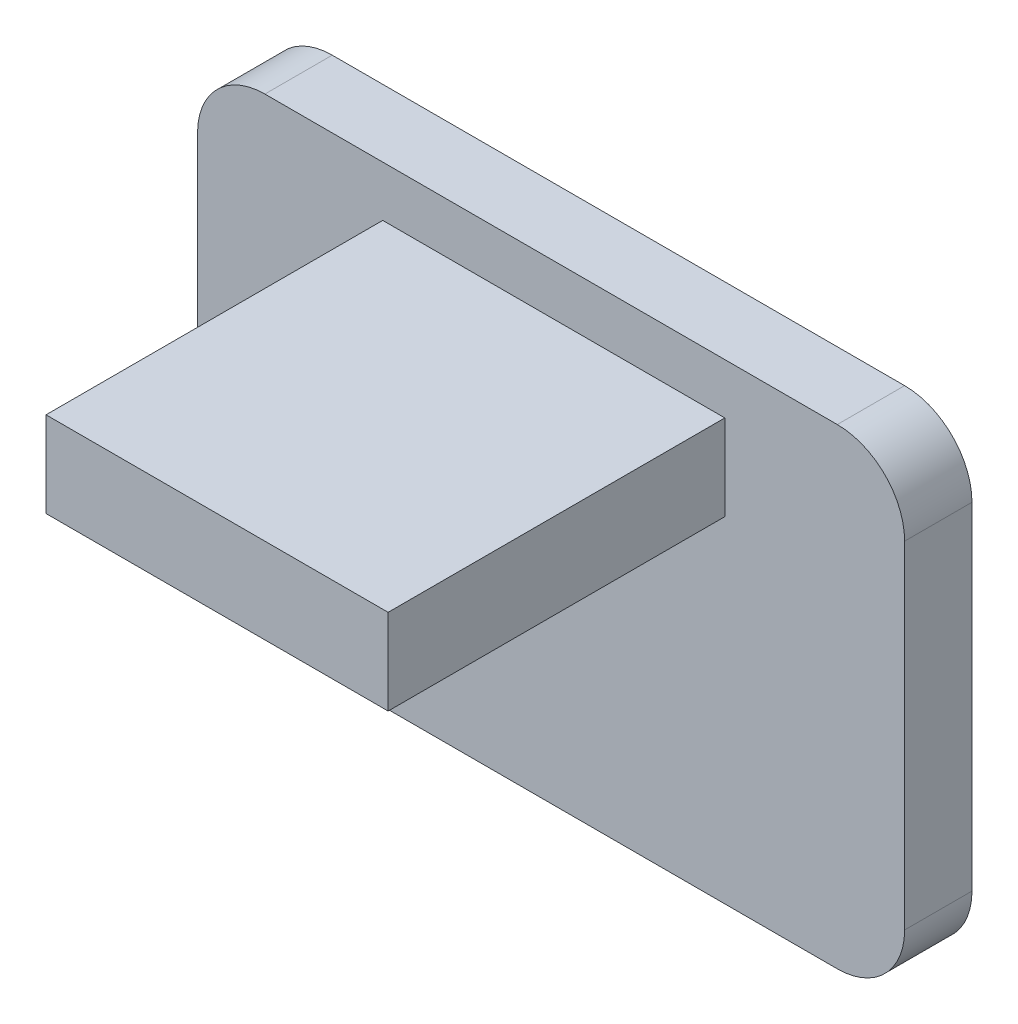
from build123d import *

# Parameters (mm, degrees)
DODANIE_WYCI_GNI_CIE1_DEPTH = 2
SZKIC2_W                    = 10.16
SZKIC2_H                    = 2.54
DODANIE_WYCI_GNI_CIE2_DEPTH = 10


with BuildPart() as part:
    # Szkic1 → Dodanie-wyciągnięcie1 (new body)
    with BuildSketch(Plane.XY):
        with BuildLine():
            Line((-8.932319644, 11.49408284), (8.067680356, 11.49408284))
            ThreePointArc((8.067680356, 11.49408284), (9.481893919, 10.908296403), (10.067680356, 9.49408284))
            Line((10.067680356, 9.49408284), (10.067680356, -0.50591716))
            ThreePointArc((10.067680356, -0.50591716), (9.481893919, -1.920130722), (8.067680356, -2.50591716))
            Line((8.067680356, -2.50591716), (-8.932319644, -2.50591716))
            ThreePointArc((-8.932319644, -2.50591716), (-10.346533206, -1.920130722), (-10.932319644, -0.50591716))
            Line((-10.932319644, -0.50591716), (-10.932319644, 9.49408284))
            ThreePointArc((-10.932319644, 9.49408284), (-10.346533206, 10.908296403), (-8.932319644, 11.49408284))
        make_face()
    extrude(amount=DODANIE_WYCI_GNI_CIE1_DEPTH)

    # Szkic2 → Dodanie-wyciągnięcie2 (add)
    with BuildSketch(Plane.XY.offset(2)):
        with Locations((-0.352319644, 8.72408284)):
            Rectangle(SZKIC2_W, SZKIC2_H)
    extrude(amount=DODANIE_WYCI_GNI_CIE2_DEPTH)


solid = part.part
